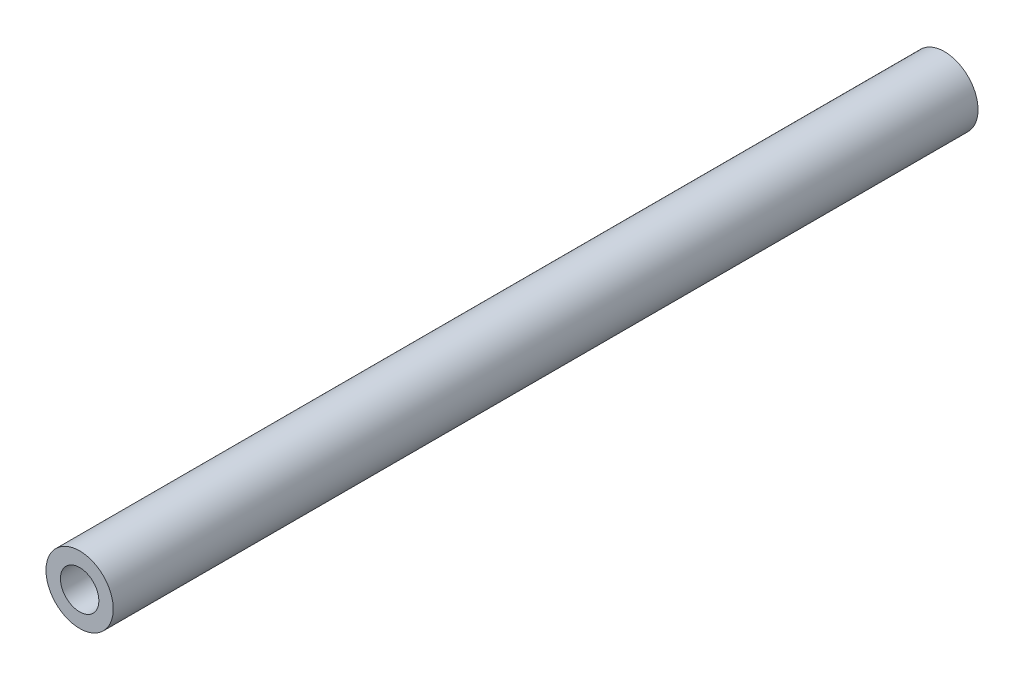
from build123d import *

# Parameters (mm, degrees)
SKETCH_1_R      = 1.75
SKETCH_1_R_2    = 1
EXTRUDE_1_DEPTH = 22.5


with BuildPart() as part:
    # 草图1 → 凸台-拉伸1 (new, symmetric)
    with BuildSketch(Plane.XY):
        with Locations(Location((0, 0, 0), (0, 0, 180))):
            Circle(SKETCH_1_R)
        with Locations(Location((0, 0, 0), (0, 0, 180))):
            Circle(SKETCH_1_R_2, mode=Mode.SUBTRACT)
    extrude(amount=EXTRUDE_1_DEPTH, both=True)


solid = part.part
